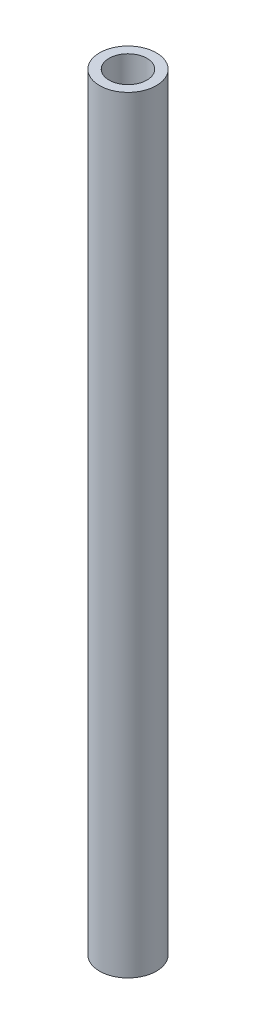
from build123d import *

# Parameters (mm, degrees)
BASE_OUTLINE_SKETCH_R   = 3
BASE_OUTLINE_SKETCH_R_2 = 2
BASE_OUTLINE_DEPTH      = 81


with BuildPart() as part:
    # Base Outline Sketch → Base Outline (new body)
    with BuildSketch(Plane(origin=(0, -150.6, 0), x_dir=(1, 0, 0), z_dir=(0, 1, 0))):
        with Locations(Location((-56.291651246, -50, 0), (0, 0, 270))):
            Circle(BASE_OUTLINE_SKETCH_R)
        with Locations(Location((-56.291651246, -50, 0), (0, 0, 270))):
            Circle(BASE_OUTLINE_SKETCH_R_2, mode=Mode.SUBTRACT)
    extrude(amount=BASE_OUTLINE_DEPTH)


solid = part.part
